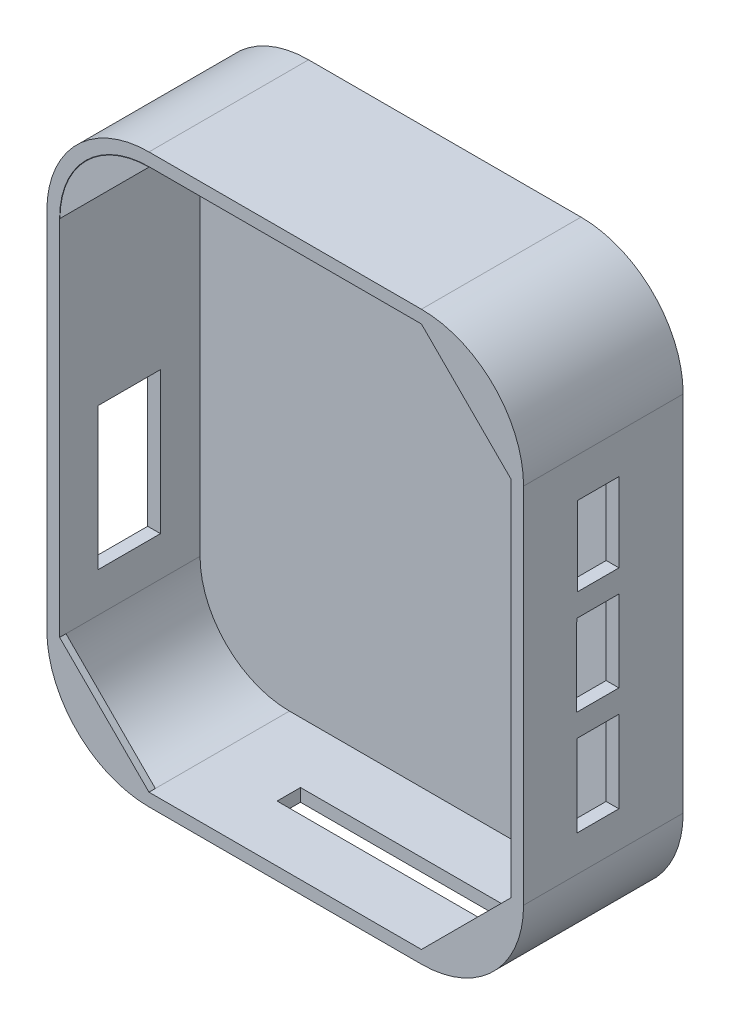
from build123d import *

# Parameters (mm, degrees)
EXTRUDE_2_DEPTH      = 1.5
EXTRUDE_4_DEPTH      = 11
EXTRUDE_6_DEPTH      = 0.5
EXTRUDE_START        = -0.5
EXTRUDE_7_DEPTH      = 0.5
EXTRUDE_8_DEPTH      = 0.5
EXTRUDE_9_DEPTH      = 0.5
SKETCH_12_W          = 4.897675457
SKETCH_12_H          = 11.127806736
CUT_EXTRUDE_3_DEPTH  = 3
SKETCH_13_W          = 3.241108758
SKETCH_13_H          = 6.19411896
CUT_EXTRUDE_4_DEPTH  = 3
SKETCH_14_W          = 3.313133397
SKETCH_14_H          = 6.122094321
CUT_EXTRUDE_5_DEPTH  = 3
SKETCH_15_W          = 2.880985563
SKETCH_15_H          = 6.266143599
CUT_EXTRUDE_6_DEPTH  = 3
SKETCH_16_W          = 15.721601541
SKETCH_16_H          = 1.836163931
CUT_EXTRUDE_7_DEPTH  = 3
SKETCH_19_W          = 3.275209086
SKETCH_19_H          = 6.371405254
SKETCH_19_H_2        = 6.414210644
CUT_EXTRUDE_10_DEPTH = 3


with BuildPart() as part:
    # 草图1 → 凸台-拉伸2 (new body)
    with BuildSketch(Plane.XY):
        with BuildLine():
            Line((-10.67, 22.215), (10.67, 22.215))
            ThreePointArc((10.67, 22.215), (16.326854249, 19.871854249), (18.67, 14.215))
            Line((18.67, 14.215), (18.67, -14.215))
            ThreePointArc((18.67, -14.215), (16.326854249, -19.871854249), (10.67, -22.215))
            Line((10.67, -22.215), (-10.67, -22.215))
            ThreePointArc((-10.67, -22.215), (-16.326854249, -19.871854249), (-18.67, -14.215))
            Line((-18.67, -14.215), (-18.67, 14.215))
            ThreePointArc((-18.67, 14.215), (-16.326854249, 19.871854249), (-10.67, 22.215))
        make_face()
    extrude(amount=EXTRUDE_2_DEPTH)

    # 草图4 → 凸台-拉伸4 (add)
    with BuildSketch(Plane.XY.offset(1.5)):
        with BuildLine():
            Line((18.67, -14.215), (18.67, 14.215))
            ThreePointArc((18.67, 14.215), (16.326854249, 19.871854249), (10.67, 22.215))
            Line((10.67, 22.215), (-10.67, 22.215))
            ThreePointArc((-10.67, 22.215), (-16.326854249, 19.871854249), (-18.67, 14.215))
            Line((-18.67, 14.215), (-18.67, -14.215))
            ThreePointArc((-18.67, -14.215), (-16.326854249, -19.871854249), (-10.67, -22.215))
            Line((-10.67, -22.215), (10.67, -22.215))
            ThreePointArc((10.67, -22.215), (16.326854249, -19.871854249), (18.67, -14.215))
        make_face()
        with BuildLine():
            Line((17.67, -14.215), (17.67, 14.215))
            ThreePointArc((17.67, 14.215), (15.619747468, 19.164747468), (10.67, 21.215))
            Line((10.67, 21.215), (-10.67, 21.215))
            ThreePointArc((-10.67, 21.215), (-15.619747468, 19.164747468), (-17.67, 14.215))
            Line((-17.67, 14.215), (-17.67, -14.215))
            ThreePointArc((-17.67, -14.215), (-15.619747468, -19.164747468), (-10.67, -21.215))
            Line((-10.67, -21.215), (10.67, -21.215))
            ThreePointArc((10.67, -21.215), (15.619747468, -19.164747468), (17.67, -14.215))
        make_face(mode=Mode.SUBTRACT)
    extrude(amount=EXTRUDE_4_DEPTH)

    # 草图8 → 凸台-拉伸7 (add)
    with BuildSketch(Plane.XY.offset(12.5).offset(EXTRUDE_START)):
        with BuildLine():
            Line((-17.67, -14.215), (-10.67, -21.215))
            ThreePointArc((-10.67, -21.215), (-15.619747468, -19.164747468), (-17.67, -14.215))
        make_face()
    extrude(amount=EXTRUDE_7_DEPTH)

    # 草图9 → 凸台-拉伸8 (add)
    with BuildSketch(Plane.XY.offset(12.5).offset(EXTRUDE_START)):
        with BuildLine():
            Line((10.67, 21.215), (17.67, 14.215))
            ThreePointArc((17.67, 14.215), (15.619747468, 19.164747468), (10.67, 21.215))
        make_face()
    extrude(amount=EXTRUDE_8_DEPTH)

    # 草图10 → 凸台-拉伸9 (add)
    with BuildSketch(Plane.XY.offset(12.5).offset(EXTRUDE_START)):
        with BuildLine():
            Line((17.67, -14.215), (10.67, -21.215))
            ThreePointArc((10.67, -21.215), (15.619747468, -19.164747468), (17.67, -14.215))
        make_face()
    extrude(amount=EXTRUDE_9_DEPTH)

    # 草图12 → 切除-拉伸3 (cut)
    with BuildSketch(Plane.ZY.offset(18.67)):
        with Locations((7.050780577, -5.563903368)):
            Rectangle(SKETCH_12_W, SKETCH_12_H)
    extrude(amount=-CUT_EXTRUDE_3_DEPTH, mode=Mode.SUBTRACT)

    # 草图13 → 切除-拉伸4 (cut)
    with BuildSketch(Plane(origin=(18.67, 0, 0), x_dir=(0, 0, -1), z_dir=(1, 0, 0))):
        with Locations((-6.646601976, 8.030747256)):
            Rectangle(SKETCH_13_W, SKETCH_13_H)
    extrude(amount=-CUT_EXTRUDE_4_DEPTH, mode=Mode.SUBTRACT)

    # 草图14 → 切除-拉伸5 (cut)
    with BuildSketch(Plane(origin=(18.67, 0, 0), x_dir=(0, 0, -1), z_dir=(1, 0, 0))):
        with Locations((-6.690937152, -0.144049279)):
            Rectangle(SKETCH_14_W, SKETCH_14_H)
    extrude(amount=-CUT_EXTRUDE_5_DEPTH, mode=Mode.SUBTRACT)

    # 草图15 → 切除-拉伸6 (cut)
    with BuildSketch(Plane(origin=(18.67, 0, 0), x_dir=(0, 0, -1), z_dir=(1, 0, 0))):
        with Locations((-6.664861945, -8.210808854)):
            Rectangle(SKETCH_15_W, SKETCH_15_H)
    extrude(amount=-CUT_EXTRUDE_6_DEPTH, mode=Mode.SUBTRACT)

    # 草图16 → 切除-拉伸7 (cut)
    with BuildSketch(Plane.XZ.offset(22.215)):
        with Locations((2.809199229, 7.168081965)):
            Rectangle(SKETCH_16_W, SKETCH_16_H)
    extrude(amount=-CUT_EXTRUDE_7_DEPTH, mode=Mode.SUBTRACT)

    # 草图19 → 切除-拉伸10 (cut)
    with BuildSketch(Plane(origin=(18.67, 0, 0), x_dir=(0, 0, -1), z_dir=(1, 0, 0))):
        with Locations((-6.671974996, -0.019393812)):
            Rectangle(SKETCH_19_W, SKETCH_19_H)
        with Locations((-6.671974996, -8.200049753)):
            Rectangle(SKETCH_19_W, SKETCH_19_H_2)
    extrude(amount=-CUT_EXTRUDE_10_DEPTH, mode=Mode.SUBTRACT)


with BuildPart() as body_2:
    # 草图5 → 凸台-拉伸6 (new body)
    with BuildSketch(Plane.XY.offset(12.5)):
        with BuildLine():
            Line((-10.67, 21.185844562), (-17.640844562, 14.215))
            ThreePointArc((-17.640844562, 14.215), (-15.59913146, 19.14413146), (-10.67, 21.185844562))
        make_face()
    extrude(amount=-EXTRUDE_6_DEPTH)


solid = Compound([part.part, body_2.part])
